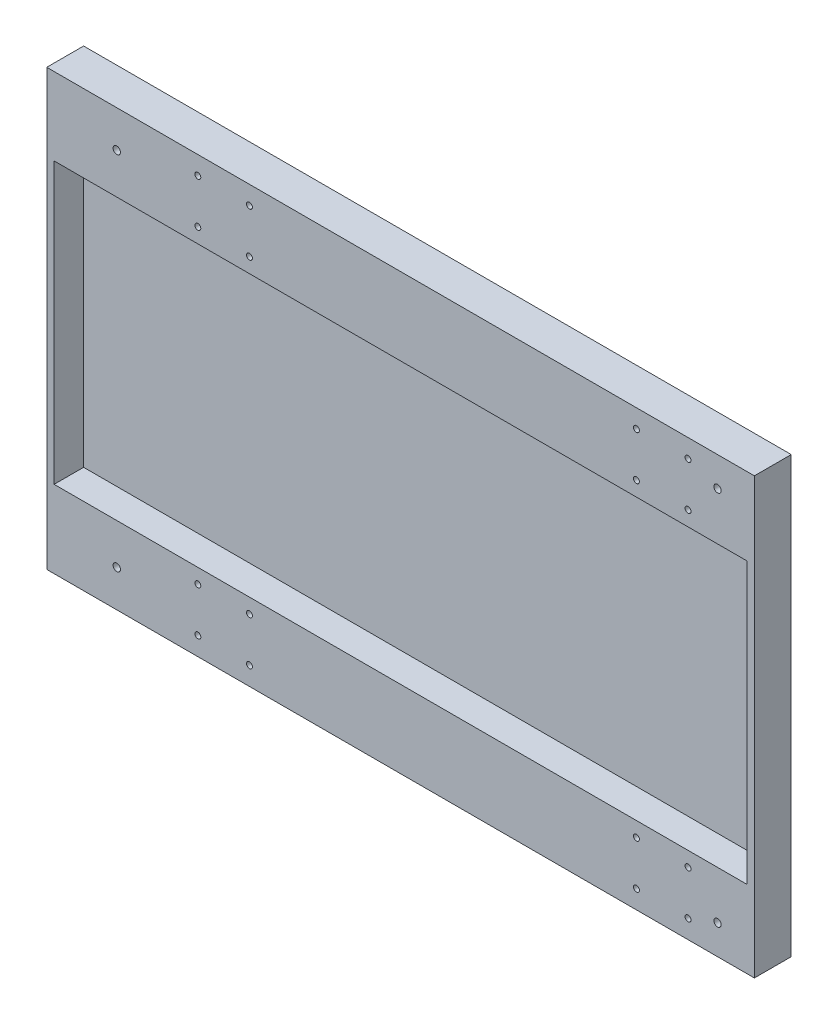
from build123d import *

# Parameters (mm, degrees)
SKETCH1_W           = 1219.2
SKETCH1_H           = 749.3
BOSS_EXTRUDE1_DEPTH = 12.7
SKETCH2_W           = 1219.2
SKETCH2_H           = 749.3
SKETCH2_W_2         = 1193.8
SKETCH2_H_2         = 482.6
SKETCH2_R           = 5.08
BOSS_EXTRUDE2_DEPTH = 50.8
SKETCH3_R           = 6.35
CUT_EXTRUDE1_DEPTH  = 719.336294851


with BuildPart() as part:
    # Sketch1 → Boss-Extrude1 (new body)
    with BuildSketch(Plane.XY):
        Rectangle(SKETCH1_W, SKETCH1_H)
    extrude(amount=BOSS_EXTRUDE1_DEPTH)

    # Sketch2 → Boss-Extrude2 (add)
    with BuildSketch(Plane.XY.offset(12.7)):
        Rectangle(SKETCH2_W, SKETCH2_H)
        Rectangle(SKETCH2_W_2, SKETCH2_H_2, mode=Mode.SUBTRACT)
        with Locations(Location((495.3, -266.7, 0), (0, 0, 180))):
            Circle(SKETCH2_R, mode=Mode.SUBTRACT)
        with Locations(Location((406.4, -266.7, 0), (0, 0, 180))):
            Circle(SKETCH2_R, mode=Mode.SUBTRACT)
        with Locations(Location((-349.25, -342.9, 0), (0, 0, 180))):
            Circle(SKETCH2_R, mode=Mode.SUBTRACT)
        with Locations(Location((-349.25, -266.7, 0), (0, 0, 180))):
            Circle(SKETCH2_R, mode=Mode.SUBTRACT)
        with Locations(Location((-260.35, -342.9, 0), (0, 0, 180))):
            Circle(SKETCH2_R, mode=Mode.SUBTRACT)
        with Locations(Location((-260.35, -266.7, 0), (0, 0, 180))):
            Circle(SKETCH2_R, mode=Mode.SUBTRACT)
        with Locations(Location((406.4, -342.9, 0), (0, 0, 180))):
            Circle(SKETCH2_R, mode=Mode.SUBTRACT)
        with Locations(Location((495.3, -342.9, 0), (0, 0, 180))):
            Circle(SKETCH2_R, mode=Mode.SUBTRACT)
        with Locations((406.4, 342.9)):
            Circle(SKETCH2_R, mode=Mode.SUBTRACT)
        with Locations((495.3, 266.7)):
            Circle(SKETCH2_R, mode=Mode.SUBTRACT)
        with Locations((406.4, 266.7)):
            Circle(SKETCH2_R, mode=Mode.SUBTRACT)
        with Locations((495.3, 342.9)):
            Circle(SKETCH2_R, mode=Mode.SUBTRACT)
        with Locations((-260.35, 266.7)):
            Circle(SKETCH2_R, mode=Mode.SUBTRACT)
        with Locations((-349.25, 342.9)):
            Circle(SKETCH2_R, mode=Mode.SUBTRACT)
        with Locations((-349.25, 266.7)):
            Circle(SKETCH2_R, mode=Mode.SUBTRACT)
        with Locations((-260.35, 342.9)):
            Circle(SKETCH2_R, mode=Mode.SUBTRACT)
    extrude(amount=BOSS_EXTRUDE2_DEPTH)

    # Sketch3 → Cut-Extrude1 (cut, through all)
    with BuildSketch(Plane.XY.offset(63.5)):
        with Locations((-488.95, 311.15)):
            Circle(SKETCH3_R)
        with Locations((546.1, 323.85)):
            Circle(SKETCH3_R)
        with Locations(Location((546.1, -323.85, 0), (0, 0, 180))):
            Circle(SKETCH3_R)
        with Locations(Location((-488.95, -311.15, 0), (0, 0, 180))):
            Circle(SKETCH3_R)
    extrude(amount=-CUT_EXTRUDE1_DEPTH, mode=Mode.SUBTRACT)


solid = part.part
